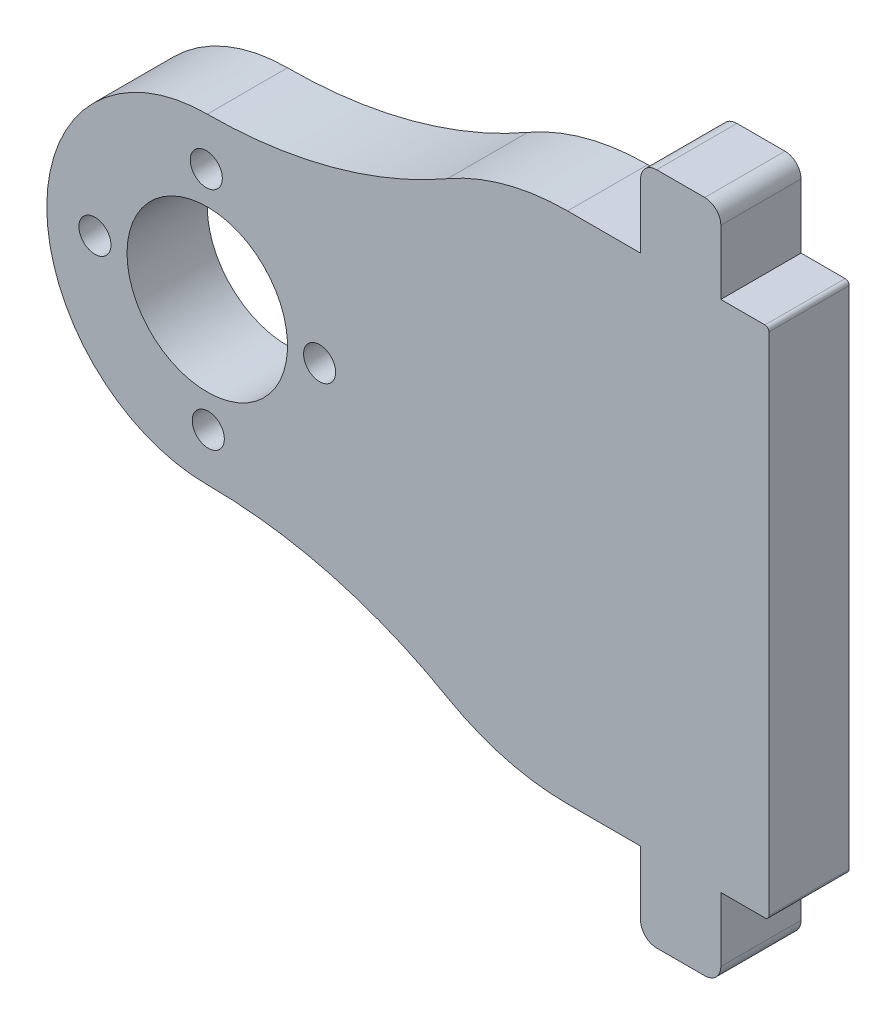
from build123d import *

# Parameters (mm, degrees)
SKETCH1_R           = 1
SKETCH1_R_2         = 1.5
BOSS_EXTRUDE1_DEPTH = 5
SKETCH2_R           = 5
CUT_EXTRUDE1_DEPTH  = 5
SKETCH3_W           = 1.4355807
SKETCH3_H           = 6.545274718
SKETCH3_W_2         = 3.269456696
SKETCH3_H_2         = 6.030331239
CUT_EXTRUDE2_DEPTH  = 5
SKETCH4_W           = 3.74989662
SKETCH4_H           = 42
BOSS_EXTRUDE2_DEPTH = 5
FILLET1_R           = 1


with BuildPart() as part:
    # Sketch1 → Boss-Extrude1 (new body)
    with BuildSketch(Plane.XY):
        with BuildLine():
            Line((19.25, -21), (14.5, -21))
            Line((14.5, -21), (14.5, -16))
            Line((14.5, -16), (13.407179423, -16))
            Line((13.407179423, -16), (9.949944321, -16))
            ThreePointArc((9.949944321, -16), (6.076960974, -15.491376746), (2.466629547, -14))
            ThreePointArc((2.466629547, -14), (-4.754033308, -11.017246508), (-12.5, -10))
            ThreePointArc((-12.5, -10), (-22.5, 0), (-12.5, 10))
            ThreePointArc((-12.5, 10), (-4.754033308, 11.017246508), (2.466629547, 14))
            ThreePointArc((2.466629547, 14), (6.076960974, 15.491376746), (9.949944321, 16))
            Line((9.949944321, 16), (13.407179423, 16))
            Line((13.407179423, 16), (14.5, 16))
            Line((14.5, 16), (14.5, 21))
            Line((14.5, 21), (19.25, 21))
            ThreePointArc((19.25, 21), (19.426776695, 20.926776695), (19.5, 20.75))
            Line((19.5, 20.75), (19.5, 16.25))
            ThreePointArc((19.5, 16.25), (19.573223305, 16.073223305), (19.75, 16))
            Line((19.75, 16), (22.25, 16))
            ThreePointArc((22.25, 16), (22.426776695, 15.926776695), (22.5, 15.75))
            Line((22.5, 15.75), (22.5, -15.75))
            ThreePointArc((22.5, -15.75), (22.426776695, -15.926776695), (22.25, -16))
            Line((22.25, -16), (19.75, -16))
            ThreePointArc((19.75, -16), (19.573223305, -16.073223305), (19.5, -16.25))
            Line((19.5, -16.25), (19.5, -20.75))
            ThreePointArc((19.5, -20.75), (19.426776695, -20.926776695), (19.25, -21))
        make_face()
        with Locations((-19.5, -0.062454575)):
            Circle(SKETCH1_R, mode=Mode.SUBTRACT)
        with Locations((-12.562454575, 7)):
            Circle(SKETCH1_R, mode=Mode.SUBTRACT)
        with Locations((-5.5, 0.062454575)):
            Circle(SKETCH1_R, mode=Mode.SUBTRACT)
        with Locations((-12.5, 0)):
            Circle(SKETCH1_R_2, mode=Mode.SUBTRACT)
        with Locations((-12.437545425, -7)):
            Circle(SKETCH1_R, mode=Mode.SUBTRACT)
    extrude(amount=BOSS_EXTRUDE1_DEPTH)

    # Sketch2 → Cut-Extrude1 (cut)
    with BuildSketch(Plane(origin=(0, 0, 0), x_dir=(-1, 0, 0), z_dir=(0, 0, -1))):
        with Locations((12.5, 0)):
            Circle(SKETCH2_R)
    extrude(amount=-CUT_EXTRUDE1_DEPTH, mode=Mode.SUBTRACT)

    # Sketch3 → Cut-Extrude2 (cut)
    with BuildSketch(Plane(origin=(0, 0, 0), x_dir=(-1, 0, 0), z_dir=(0, 0, -1))):
        with Locations((-20.21779035, 19.272637359)):
            Rectangle(SKETCH3_W, SKETCH3_H)
        with Locations((-21.134728348, -19.01516562)):
            Rectangle(SKETCH3_W_2, SKETCH3_H_2)
    extrude(amount=-CUT_EXTRUDE2_DEPTH, mode=Mode.SUBTRACT)

    # Sketch4 → Boss-Extrude2 (add)
    with BuildSketch(Plane(origin=(0, 0, 0), x_dir=(-1, 0, 0), z_dir=(0, 0, -1))):
        with Locations((-17.62505169, 0)):
            Rectangle(SKETCH4_W, SKETCH4_H)
    extrude(amount=-BOSS_EXTRUDE2_DEPTH)

    # Fillet1
    fillet1_edges = [part.edges().sort_by_distance(p)[0] for p in [
        (19.5, -21, 2.5),
        (19.5, 21, 2.5),
        (14.5, 21, 2.5),
        (14.5, -21, 2.5),
    ]]
    fillet(fillet1_edges, radius=FILLET1_R)


solid = part.part
